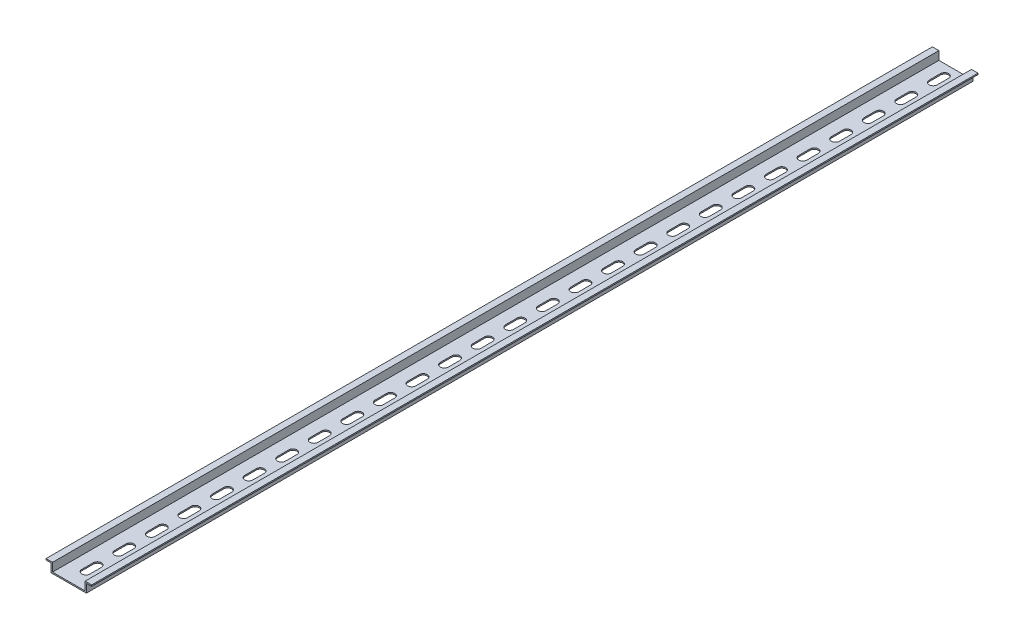
from build123d import *

# Parameters (mm, degrees)
BOSS_EXTRUDE1_DEPTH   = 680
CUT_EXTRUDE1_DEPTH    = 681.266491899
LPATTERN1_COUNT       = 27
LPATTERN1_PITCH       = 25
MIRROR2_COPY_1_DEPTH  = 681.266491899
MIRROR2_COPY_2_DEPTH  = 681.266491899
MIRROR2_COPY_3_DEPTH  = 681.266491899
MIRROR2_COPY_4_DEPTH  = 681.266491899
MIRROR2_COPY_5_DEPTH  = 681.266491899
MIRROR2_COPY_6_DEPTH  = 681.266491899
MIRROR2_COPY_7_DEPTH  = 681.266491899
MIRROR2_COPY_8_DEPTH  = 681.266491899
MIRROR2_COPY_9_DEPTH  = 681.266491899
MIRROR2_COPY_10_DEPTH = 681.266491899
MIRROR2_COPY_11_DEPTH = 681.266491899
MIRROR2_COPY_12_DEPTH = 681.266491899
MIRROR2_COPY_13_DEPTH = 681.266491899
MIRROR2_COPY_14_DEPTH = 681.266491899
MIRROR2_COPY_15_DEPTH = 681.266491899
MIRROR2_COPY_16_DEPTH = 681.266491899
MIRROR2_COPY_17_DEPTH = 681.266491899
MIRROR2_COPY_18_DEPTH = 681.266491899
MIRROR2_COPY_19_DEPTH = 681.266491899
MIRROR2_COPY_20_DEPTH = 681.266491899
MIRROR2_COPY_21_DEPTH = 681.266491899
MIRROR2_COPY_22_DEPTH = 681.266491899
MIRROR2_COPY_23_DEPTH = 681.266491899
MIRROR2_COPY_24_DEPTH = 681.266491899
MIRROR2_COPY_25_DEPTH = 681.266491899
MIRROR2_COPY_26_DEPTH = 681.266491899


with BuildPart() as part:
    # Sketch1 → Boss-Extrude1 (new body)
    with BuildSketch(Plane.XY):
        Polygon((0, 0), (13.5, 0), (13.5, 6.5), (17.5, 6.5), (17.5, 7.5), (12.5, 7.5), (12.5, 1), (0, 1), align=None)
    boss_extrude1 = extrude(amount=BOSS_EXTRUDE1_DEPTH)

    # Sketch2 → Cut-Extrude1 (cut, through all)
    with BuildSketch(Plane(origin=(0, 0, 0), x_dir=(1, 0, 0), z_dir=(0, 1, 0))):
        with BuildLine():
            Line((3.1, -8.1), (3.1, -16.9))
            ThreePointArc((3.1, -16.9), (0, -20), (-3.1, -16.9))
            Line((-3.1, -16.9), (-3.1, -8.1))
            ThreePointArc((-3.1, -8.1), (0, -5), (3.1, -8.1))
        make_face()
    cut_extrude1 = extrude(amount=CUT_EXTRUDE1_DEPTH, mode=Mode.SUBTRACT)

    # LPattern1: Cut-Extrude1 ×27
    with Locations(*[(0, 0, i * LPATTERN1_PITCH) for i in range(1, LPATTERN1_COUNT)]):
        add(cut_extrude1, mode=Mode.SUBTRACT)

    # Mirror2: Boss-Extrude1, Cut-Extrude1 across plane
    add(boss_extrude1.mirror(Plane(origin=(0, 0, 0), x_dir=(0, 0, 1), z_dir=(1, 0, 0))))
    add(cut_extrude1.mirror(Plane(origin=(0, 0, 0), x_dir=(0, 0, 1), z_dir=(1, 0, 0))), mode=Mode.SUBTRACT)

    # Mirror2 copy 1 sketch → Mirror2 copy 1 (cut, through all)
    with BuildSketch(Plane(origin=(0, 0, 25), x_dir=(-1, 0, 0), z_dir=(0, 1, 0))):
        with BuildLine():
            Line((3.1, 8.1), (3.1, 16.9))
            ThreePointArc((3.1, 16.9), (0, 20), (-3.1, 16.9))
            Line((-3.1, 16.9), (-3.1, 8.1))
            ThreePointArc((-3.1, 8.1), (0, 5), (3.1, 8.1))
        make_face()
    extrude(amount=MIRROR2_COPY_1_DEPTH, mode=Mode.SUBTRACT)

    # Mirror2 copy 2 sketch → Mirror2 copy 2 (cut, through all)
    with BuildSketch(Plane(origin=(0, 0, 50), x_dir=(-1, 0, 0), z_dir=(0, 1, 0))):
        with BuildLine():
            Line((3.1, 8.1), (3.1, 16.9))
            ThreePointArc((3.1, 16.9), (0, 20), (-3.1, 16.9))
            Line((-3.1, 16.9), (-3.1, 8.1))
            ThreePointArc((-3.1, 8.1), (0, 5), (3.1, 8.1))
        make_face()
    extrude(amount=MIRROR2_COPY_2_DEPTH, mode=Mode.SUBTRACT)

    # Mirror2 copy 3 sketch → Mirror2 copy 3 (cut, through all)
    with BuildSketch(Plane(origin=(0, 0, 75), x_dir=(-1, 0, 0), z_dir=(0, 1, 0))):
        with BuildLine():
            Line((3.1, 8.1), (3.1, 16.9))
            ThreePointArc((3.1, 16.9), (0, 20), (-3.1, 16.9))
            Line((-3.1, 16.9), (-3.1, 8.1))
            ThreePointArc((-3.1, 8.1), (0, 5), (3.1, 8.1))
        make_face()
    extrude(amount=MIRROR2_COPY_3_DEPTH, mode=Mode.SUBTRACT)

    # Mirror2 copy 4 sketch → Mirror2 copy 4 (cut, through all)
    with BuildSketch(Plane(origin=(0, 0, 100), x_dir=(-1, 0, 0), z_dir=(0, 1, 0))):
        with BuildLine():
            Line((3.1, 8.1), (3.1, 16.9))
            ThreePointArc((3.1, 16.9), (0, 20), (-3.1, 16.9))
            Line((-3.1, 16.9), (-3.1, 8.1))
            ThreePointArc((-3.1, 8.1), (0, 5), (3.1, 8.1))
        make_face()
    extrude(amount=MIRROR2_COPY_4_DEPTH, mode=Mode.SUBTRACT)

    # Mirror2 copy 5 sketch → Mirror2 copy 5 (cut, through all)
    with BuildSketch(Plane(origin=(0, 0, 125), x_dir=(-1, 0, 0), z_dir=(0, 1, 0))):
        with BuildLine():
            Line((3.1, 8.1), (3.1, 16.9))
            ThreePointArc((3.1, 16.9), (0, 20), (-3.1, 16.9))
            Line((-3.1, 16.9), (-3.1, 8.1))
            ThreePointArc((-3.1, 8.1), (0, 5), (3.1, 8.1))
        make_face()
    extrude(amount=MIRROR2_COPY_5_DEPTH, mode=Mode.SUBTRACT)

    # Mirror2 copy 6 sketch → Mirror2 copy 6 (cut, through all)
    with BuildSketch(Plane(origin=(0, 0, 150), x_dir=(-1, 0, 0), z_dir=(0, 1, 0))):
        with BuildLine():
            Line((3.1, 8.1), (3.1, 16.9))
            ThreePointArc((3.1, 16.9), (0, 20), (-3.1, 16.9))
            Line((-3.1, 16.9), (-3.1, 8.1))
            ThreePointArc((-3.1, 8.1), (0, 5), (3.1, 8.1))
        make_face()
    extrude(amount=MIRROR2_COPY_6_DEPTH, mode=Mode.SUBTRACT)

    # Mirror2 copy 7 sketch → Mirror2 copy 7 (cut, through all)
    with BuildSketch(Plane(origin=(0, 0, 175), x_dir=(-1, 0, 0), z_dir=(0, 1, 0))):
        with BuildLine():
            Line((3.1, 8.1), (3.1, 16.9))
            ThreePointArc((3.1, 16.9), (0, 20), (-3.1, 16.9))
            Line((-3.1, 16.9), (-3.1, 8.1))
            ThreePointArc((-3.1, 8.1), (0, 5), (3.1, 8.1))
        make_face()
    extrude(amount=MIRROR2_COPY_7_DEPTH, mode=Mode.SUBTRACT)

    # Mirror2 copy 8 sketch → Mirror2 copy 8 (cut, through all)
    with BuildSketch(Plane(origin=(0, 0, 200), x_dir=(-1, 0, 0), z_dir=(0, 1, 0))):
        with BuildLine():
            Line((3.1, 8.1), (3.1, 16.9))
            ThreePointArc((3.1, 16.9), (0, 20), (-3.1, 16.9))
            Line((-3.1, 16.9), (-3.1, 8.1))
            ThreePointArc((-3.1, 8.1), (0, 5), (3.1, 8.1))
        make_face()
    extrude(amount=MIRROR2_COPY_8_DEPTH, mode=Mode.SUBTRACT)

    # Mirror2 copy 9 sketch → Mirror2 copy 9 (cut, through all)
    with BuildSketch(Plane(origin=(0, 0, 225), x_dir=(-1, 0, 0), z_dir=(0, 1, 0))):
        with BuildLine():
            Line((3.1, 8.1), (3.1, 16.9))
            ThreePointArc((3.1, 16.9), (0, 20), (-3.1, 16.9))
            Line((-3.1, 16.9), (-3.1, 8.1))
            ThreePointArc((-3.1, 8.1), (0, 5), (3.1, 8.1))
        make_face()
    extrude(amount=MIRROR2_COPY_9_DEPTH, mode=Mode.SUBTRACT)

    # Mirror2 copy 10 sketch → Mirror2 copy 10 (cut, through all)
    with BuildSketch(Plane(origin=(0, 0, 250), x_dir=(-1, 0, 0), z_dir=(0, 1, 0))):
        with BuildLine():
            Line((3.1, 8.1), (3.1, 16.9))
            ThreePointArc((3.1, 16.9), (0, 20), (-3.1, 16.9))
            Line((-3.1, 16.9), (-3.1, 8.1))
            ThreePointArc((-3.1, 8.1), (0, 5), (3.1, 8.1))
        make_face()
    extrude(amount=MIRROR2_COPY_10_DEPTH, mode=Mode.SUBTRACT)

    # Mirror2 copy 11 sketch → Mirror2 copy 11 (cut, through all)
    with BuildSketch(Plane(origin=(0, 0, 275), x_dir=(-1, 0, 0), z_dir=(0, 1, 0))):
        with BuildLine():
            Line((3.1, 8.1), (3.1, 16.9))
            ThreePointArc((3.1, 16.9), (0, 20), (-3.1, 16.9))
            Line((-3.1, 16.9), (-3.1, 8.1))
            ThreePointArc((-3.1, 8.1), (0, 5), (3.1, 8.1))
        make_face()
    extrude(amount=MIRROR2_COPY_11_DEPTH, mode=Mode.SUBTRACT)

    # Mirror2 copy 12 sketch → Mirror2 copy 12 (cut, through all)
    with BuildSketch(Plane(origin=(0, 0, 300), x_dir=(-1, 0, 0), z_dir=(0, 1, 0))):
        with BuildLine():
            Line((3.1, 8.1), (3.1, 16.9))
            ThreePointArc((3.1, 16.9), (0, 20), (-3.1, 16.9))
            Line((-3.1, 16.9), (-3.1, 8.1))
            ThreePointArc((-3.1, 8.1), (0, 5), (3.1, 8.1))
        make_face()
    extrude(amount=MIRROR2_COPY_12_DEPTH, mode=Mode.SUBTRACT)

    # Mirror2 copy 13 sketch → Mirror2 copy 13 (cut, through all)
    with BuildSketch(Plane(origin=(0, 0, 325), x_dir=(-1, 0, 0), z_dir=(0, 1, 0))):
        with BuildLine():
            Line((3.1, 8.1), (3.1, 16.9))
            ThreePointArc((3.1, 16.9), (0, 20), (-3.1, 16.9))
            Line((-3.1, 16.9), (-3.1, 8.1))
            ThreePointArc((-3.1, 8.1), (0, 5), (3.1, 8.1))
        make_face()
    extrude(amount=MIRROR2_COPY_13_DEPTH, mode=Mode.SUBTRACT)

    # Mirror2 copy 14 sketch → Mirror2 copy 14 (cut, through all)
    with BuildSketch(Plane(origin=(0, 0, 350), x_dir=(-1, 0, 0), z_dir=(0, 1, 0))):
        with BuildLine():
            Line((3.1, 8.1), (3.1, 16.9))
            ThreePointArc((3.1, 16.9), (0, 20), (-3.1, 16.9))
            Line((-3.1, 16.9), (-3.1, 8.1))
            ThreePointArc((-3.1, 8.1), (0, 5), (3.1, 8.1))
        make_face()
    extrude(amount=MIRROR2_COPY_14_DEPTH, mode=Mode.SUBTRACT)

    # Mirror2 copy 15 sketch → Mirror2 copy 15 (cut, through all)
    with BuildSketch(Plane(origin=(0, 0, 375), x_dir=(-1, 0, 0), z_dir=(0, 1, 0))):
        with BuildLine():
            Line((3.1, 8.1), (3.1, 16.9))
            ThreePointArc((3.1, 16.9), (0, 20), (-3.1, 16.9))
            Line((-3.1, 16.9), (-3.1, 8.1))
            ThreePointArc((-3.1, 8.1), (0, 5), (3.1, 8.1))
        make_face()
    extrude(amount=MIRROR2_COPY_15_DEPTH, mode=Mode.SUBTRACT)

    # Mirror2 copy 16 sketch → Mirror2 copy 16 (cut, through all)
    with BuildSketch(Plane(origin=(0, 0, 400), x_dir=(-1, 0, 0), z_dir=(0, 1, 0))):
        with BuildLine():
            Line((3.1, 8.1), (3.1, 16.9))
            ThreePointArc((3.1, 16.9), (0, 20), (-3.1, 16.9))
            Line((-3.1, 16.9), (-3.1, 8.1))
            ThreePointArc((-3.1, 8.1), (0, 5), (3.1, 8.1))
        make_face()
    extrude(amount=MIRROR2_COPY_16_DEPTH, mode=Mode.SUBTRACT)

    # Mirror2 copy 17 sketch → Mirror2 copy 17 (cut, through all)
    with BuildSketch(Plane(origin=(0, 0, 425), x_dir=(-1, 0, 0), z_dir=(0, 1, 0))):
        with BuildLine():
            Line((3.1, 8.1), (3.1, 16.9))
            ThreePointArc((3.1, 16.9), (0, 20), (-3.1, 16.9))
            Line((-3.1, 16.9), (-3.1, 8.1))
            ThreePointArc((-3.1, 8.1), (0, 5), (3.1, 8.1))
        make_face()
    extrude(amount=MIRROR2_COPY_17_DEPTH, mode=Mode.SUBTRACT)

    # Mirror2 copy 18 sketch → Mirror2 copy 18 (cut, through all)
    with BuildSketch(Plane(origin=(0, 0, 450), x_dir=(-1, 0, 0), z_dir=(0, 1, 0))):
        with BuildLine():
            Line((3.1, 8.1), (3.1, 16.9))
            ThreePointArc((3.1, 16.9), (0, 20), (-3.1, 16.9))
            Line((-3.1, 16.9), (-3.1, 8.1))
            ThreePointArc((-3.1, 8.1), (0, 5), (3.1, 8.1))
        make_face()
    extrude(amount=MIRROR2_COPY_18_DEPTH, mode=Mode.SUBTRACT)

    # Mirror2 copy 19 sketch → Mirror2 copy 19 (cut, through all)
    with BuildSketch(Plane(origin=(0, 0, 475), x_dir=(-1, 0, 0), z_dir=(0, 1, 0))):
        with BuildLine():
            Line((3.1, 8.1), (3.1, 16.9))
            ThreePointArc((3.1, 16.9), (0, 20), (-3.1, 16.9))
            Line((-3.1, 16.9), (-3.1, 8.1))
            ThreePointArc((-3.1, 8.1), (0, 5), (3.1, 8.1))
        make_face()
    extrude(amount=MIRROR2_COPY_19_DEPTH, mode=Mode.SUBTRACT)

    # Mirror2 copy 20 sketch → Mirror2 copy 20 (cut, through all)
    with BuildSketch(Plane(origin=(0, 0, 500), x_dir=(-1, 0, 0), z_dir=(0, 1, 0))):
        with BuildLine():
            Line((3.1, 8.1), (3.1, 16.9))
            ThreePointArc((3.1, 16.9), (0, 20), (-3.1, 16.9))
            Line((-3.1, 16.9), (-3.1, 8.1))
            ThreePointArc((-3.1, 8.1), (0, 5), (3.1, 8.1))
        make_face()
    extrude(amount=MIRROR2_COPY_20_DEPTH, mode=Mode.SUBTRACT)

    # Mirror2 copy 21 sketch → Mirror2 copy 21 (cut, through all)
    with BuildSketch(Plane(origin=(0, 0, 525), x_dir=(-1, 0, 0), z_dir=(0, 1, 0))):
        with BuildLine():
            Line((3.1, 8.1), (3.1, 16.9))
            ThreePointArc((3.1, 16.9), (0, 20), (-3.1, 16.9))
            Line((-3.1, 16.9), (-3.1, 8.1))
            ThreePointArc((-3.1, 8.1), (0, 5), (3.1, 8.1))
        make_face()
    extrude(amount=MIRROR2_COPY_21_DEPTH, mode=Mode.SUBTRACT)

    # Mirror2 copy 22 sketch → Mirror2 copy 22 (cut, through all)
    with BuildSketch(Plane(origin=(0, 0, 550), x_dir=(-1, 0, 0), z_dir=(0, 1, 0))):
        with BuildLine():
            Line((3.1, 8.1), (3.1, 16.9))
            ThreePointArc((3.1, 16.9), (0, 20), (-3.1, 16.9))
            Line((-3.1, 16.9), (-3.1, 8.1))
            ThreePointArc((-3.1, 8.1), (0, 5), (3.1, 8.1))
        make_face()
    extrude(amount=MIRROR2_COPY_22_DEPTH, mode=Mode.SUBTRACT)

    # Mirror2 copy 23 sketch → Mirror2 copy 23 (cut, through all)
    with BuildSketch(Plane(origin=(0, 0, 575), x_dir=(-1, 0, 0), z_dir=(0, 1, 0))):
        with BuildLine():
            Line((3.1, 8.1), (3.1, 16.9))
            ThreePointArc((3.1, 16.9), (0, 20), (-3.1, 16.9))
            Line((-3.1, 16.9), (-3.1, 8.1))
            ThreePointArc((-3.1, 8.1), (0, 5), (3.1, 8.1))
        make_face()
    extrude(amount=MIRROR2_COPY_23_DEPTH, mode=Mode.SUBTRACT)

    # Mirror2 copy 24 sketch → Mirror2 copy 24 (cut, through all)
    with BuildSketch(Plane(origin=(0, 0, 600), x_dir=(-1, 0, 0), z_dir=(0, 1, 0))):
        with BuildLine():
            Line((3.1, 8.1), (3.1, 16.9))
            ThreePointArc((3.1, 16.9), (0, 20), (-3.1, 16.9))
            Line((-3.1, 16.9), (-3.1, 8.1))
            ThreePointArc((-3.1, 8.1), (0, 5), (3.1, 8.1))
        make_face()
    extrude(amount=MIRROR2_COPY_24_DEPTH, mode=Mode.SUBTRACT)

    # Mirror2 copy 25 sketch → Mirror2 copy 25 (cut, through all)
    with BuildSketch(Plane(origin=(0, 0, 625), x_dir=(-1, 0, 0), z_dir=(0, 1, 0))):
        with BuildLine():
            Line((3.1, 8.1), (3.1, 16.9))
            ThreePointArc((3.1, 16.9), (0, 20), (-3.1, 16.9))
            Line((-3.1, 16.9), (-3.1, 8.1))
            ThreePointArc((-3.1, 8.1), (0, 5), (3.1, 8.1))
        make_face()
    extrude(amount=MIRROR2_COPY_25_DEPTH, mode=Mode.SUBTRACT)

    # Mirror2 copy 26 sketch → Mirror2 copy 26 (cut, through all)
    with BuildSketch(Plane(origin=(0, 0, 650), x_dir=(-1, 0, 0), z_dir=(0, 1, 0))):
        with BuildLine():
            Line((3.1, 8.1), (3.1, 16.9))
            ThreePointArc((3.1, 16.9), (0, 20), (-3.1, 16.9))
            Line((-3.1, 16.9), (-3.1, 8.1))
            ThreePointArc((-3.1, 8.1), (0, 5), (3.1, 8.1))
        make_face()
    extrude(amount=MIRROR2_COPY_26_DEPTH, mode=Mode.SUBTRACT)


solid = part.part
